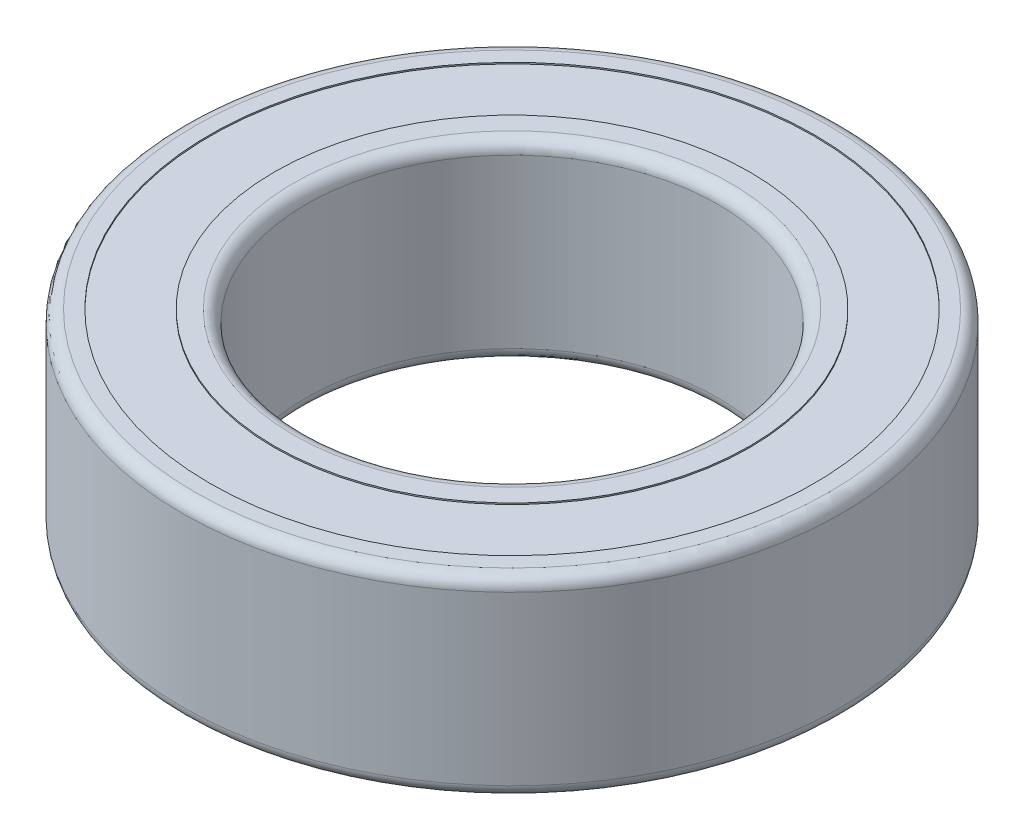
from build123d import *

# Parameters (mm, degrees)
SKETCH1_R           = 12
SKETCH1_R_2         = 7.5
BOSS_EXTRUDE1_DEPTH = 3.5
SKETCH2_R           = 11
SKETCH2_R_2         = 8.65
CUT_EXTRUDE1_DEPTH  = 0.05
FILLET1_R           = 0.45


with BuildPart() as part:
    # Sketch1 → Boss-Extrude1 (new, symmetric)
    with BuildSketch(Plane(origin=(0, 0, 0), x_dir=(1, 0, 0), z_dir=(0, 1, 0))):
        Circle(SKETCH1_R)
        Circle(SKETCH1_R_2, mode=Mode.SUBTRACT)
    extrude(amount=BOSS_EXTRUDE1_DEPTH, both=True)

    # Sketch2 → Cut-Extrude1 (cut)
    with BuildSketch(Plane(origin=(0, 3.5, 0), x_dir=(1, 0, 0), z_dir=(0, 1, 0))):
        Circle(SKETCH2_R)
        Circle(SKETCH2_R_2, mode=Mode.SUBTRACT)
    cut_extrude1 = extrude(amount=-CUT_EXTRUDE1_DEPTH, mode=Mode.SUBTRACT)

    # Mirror1: Cut-Extrude1 across plane
    add(cut_extrude1.mirror(Plane.ZX), mode=Mode.SUBTRACT)

    # Fillet1
    fillet1_edges = [part.edges().sort_by_distance(p)[0] for p in [
        (-7.5, -3.5, 0),
        (-7.5, 3.5, 0),
        (-12, -3.5, 0),
        (-12, 3.5, 0),
    ]]
    fillet(fillet1_edges, radius=FILLET1_R)


solid = part.part
